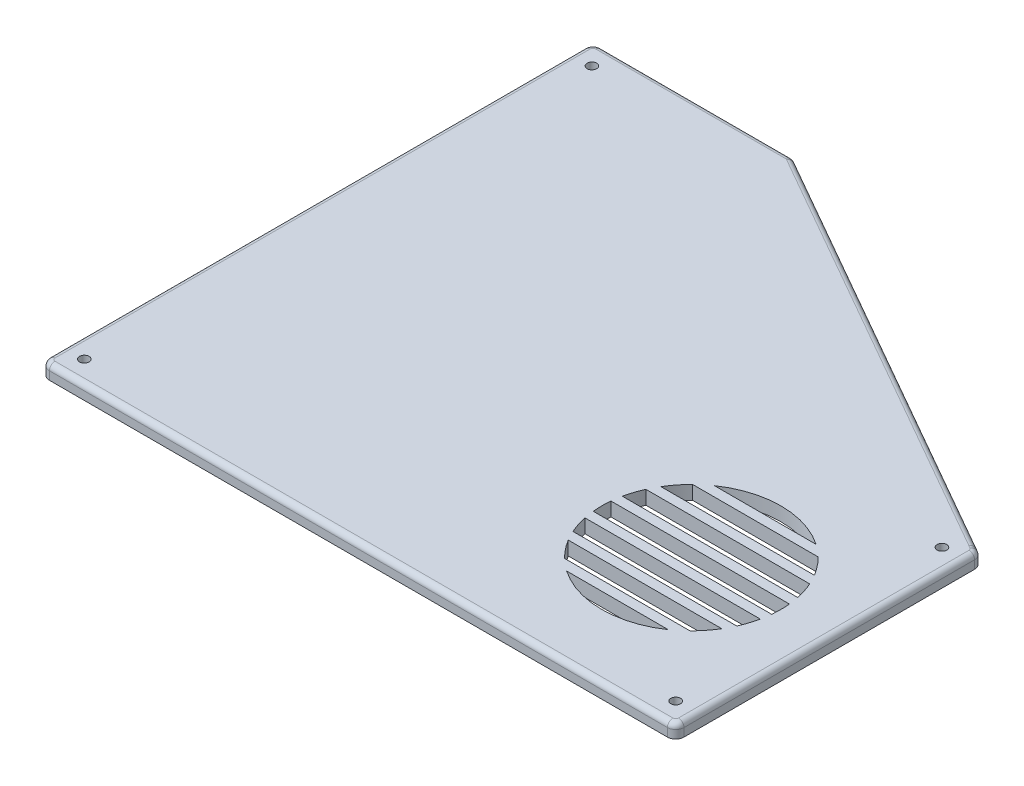
from build123d import *

# Parameters (mm, degrees)
SKETCH1_R           = 1.75
BOSS_EXTRUDE1_DEPTH = 5
CUT_EXTRUDE1_DEPTH  = 5
FILLET2_R           = 2


with BuildPart() as part:
    # Sketch1 → Boss-Extrude1 (new body)
    with BuildSketch(Plane(origin=(0, 0, 0), x_dir=(1, 0, 0), z_dir=(0, 1, 0))):
        with BuildLine():
            Line((-115, 97), (-115, -97))
            ThreePointArc((-115, -97), (-114.121320344, -99.121320344), (-112, -100))
            Line((-112, -100), (112, -100))
            ThreePointArc((112, -100), (114.121320344, -99.121320344), (115, -97))
            Line((115, -97), (115, 8.326847539))
            ThreePointArc((115, 8.326847539), (114.595001354, 9.832160786), (113.489354684, 10.931040816))
            Line((113.489354684, 10.931040816), (112.482257806, 11.50700592))
            Line((112.482257806, 11.50700592), (-41.694544071, 99.604753313))
            ThreePointArc((-41.694544071, 99.604753313), (-42.412938544, 99.899505125), (-43.182919083, 100))
            Line((-43.182919083, 100), (-112, 100))
            ThreePointArc((-112, 100), (-114.121320344, 99.121320344), (-115, 97))
        make_face()
        with Locations(Location((-107.357965586, 91.996726093, 0), (0, 0, 270))):
            Circle(SKETCH1_R, mode=Mode.SUBTRACT)
        with Locations(Location((107.171572875, 4.338256462, 0), (0, 0, 270))):
            Circle(SKETCH1_R, mode=Mode.SUBTRACT)
        with Locations(Location((107.171572875, -92.171572875, 0), (0, 0, 270))):
            Circle(SKETCH1_R, mode=Mode.SUBTRACT)
        with Locations(Location((-107.320588757, -92.030024345, 0), (0, 0, 270))):
            Circle(SKETCH1_R, mode=Mode.SUBTRACT)
    extrude(amount=BOSS_EXTRUDE1_DEPTH)

    # Sketch2 → Cut-Extrude1 (cut)
    with BuildSketch(Plane(origin=(0, 5, 0), x_dir=(1, 0, 0), z_dir=(0, 1, 0))):
        with BuildLine():
            ThreePointArc((83.411536631, -17.554766753), (65, -11.836576231), (46.588463369, -17.554766753))
            Line((46.588463369, -17.554766753), (83.411536631, -17.554766753))
        make_face()
        with BuildLine():
            ThreePointArc((42.258724115, -21.118385708), (39.509391878, -24.17525441), (37.167988383, -27.554766753))
            Line((37.167988383, -27.554766753), (92.832011617, -27.554766753))
            ThreePointArc((92.832011617, -27.554766753), (90.490608122, -24.17525441), (87.741275885, -21.118385708))
            Line((87.741275885, -21.118385708), (42.258724115, -21.118385708))
        make_face()
        with BuildLine():
            Line((94.690561452, -31.118385708), (35.309438548, -31.118385708))
            ThreePointArc((35.309438548, -31.118385708), (34.094437197, -34.281916226), (33.215458786, -37.554766753))
            Line((33.215458786, -37.554766753), (96.784541214, -37.554766753))
            ThreePointArc((96.784541214, -37.554766753), (95.905562803, -34.281916226), (94.690561452, -31.118385708))
        make_face()
        with BuildLine():
            Line((97.340272877, -41.118385708), (32.659727123, -41.118385708))
            ThreePointArc((32.659727123, -41.118385708), (32.5, -44.336576231), (32.659727123, -47.554766753))
            Line((32.659727123, -47.554766753), (97.340272877, -47.554766753))
            ThreePointArc((97.340272877, -47.554766753), (97.460043658, -45.94765219), (97.5, -44.336576231))
            ThreePointArc((97.5, -44.336576231), (97.460043658, -42.725500271), (97.340272877, -41.118385708))
        make_face()
        with BuildLine():
            Line((96.784541214, -51.118385708), (33.215458786, -51.118385708))
            ThreePointArc((33.215458786, -51.118385708), (34.094437197, -54.391236236), (35.309438548, -57.554766753))
            Line((35.309438548, -57.554766753), (94.690561452, -57.554766753))
            ThreePointArc((94.690561452, -57.554766753), (95.905562803, -54.391236236), (96.784541214, -51.118385708))
        make_face()
        with BuildLine():
            Line((92.832011617, -61.118385708), (37.167988383, -61.118385708))
            ThreePointArc((37.167988383, -61.118385708), (39.509391878, -64.497898052), (42.258724115, -67.554766753))
            Line((42.258724115, -67.554766753), (87.741275885, -67.554766753))
            ThreePointArc((87.741275885, -67.554766753), (90.490608122, -64.497898052), (92.832011617, -61.118385708))
        make_face()
        with BuildLine():
            Line((83.411536631, -71.118385708), (46.588463369, -71.118385708))
            ThreePointArc((46.588463369, -71.118385708), (65, -76.836576231), (83.411536631, -71.118385708))
        make_face()
    extrude(amount=-CUT_EXTRUDE1_DEPTH, mode=Mode.SUBTRACT)

    # Fillet2
    fillet2_edges = [part.edges().sort_by_distance(p)[0] for p in [
        (-114.121320344, 5, 99.121320344),
        (0, 5, 100),
        (114.121320344, 5, 99.121320344),
        (115, 5, 44.336576231),
        (114.595001354, 5, -9.832160786),
        (112.985806245, 5, -11.219023368),
        (35.393856868, 5, -55.555879616),
        (-42.412938544, 5, -99.899505125),
        (-77.591459542, 5, -100),
        (-114.121320344, 5, -99.121320344),
        (-115, 5, 0),
    ]]
    fillet(fillet2_edges, radius=FILLET2_R)


solid = part.part
